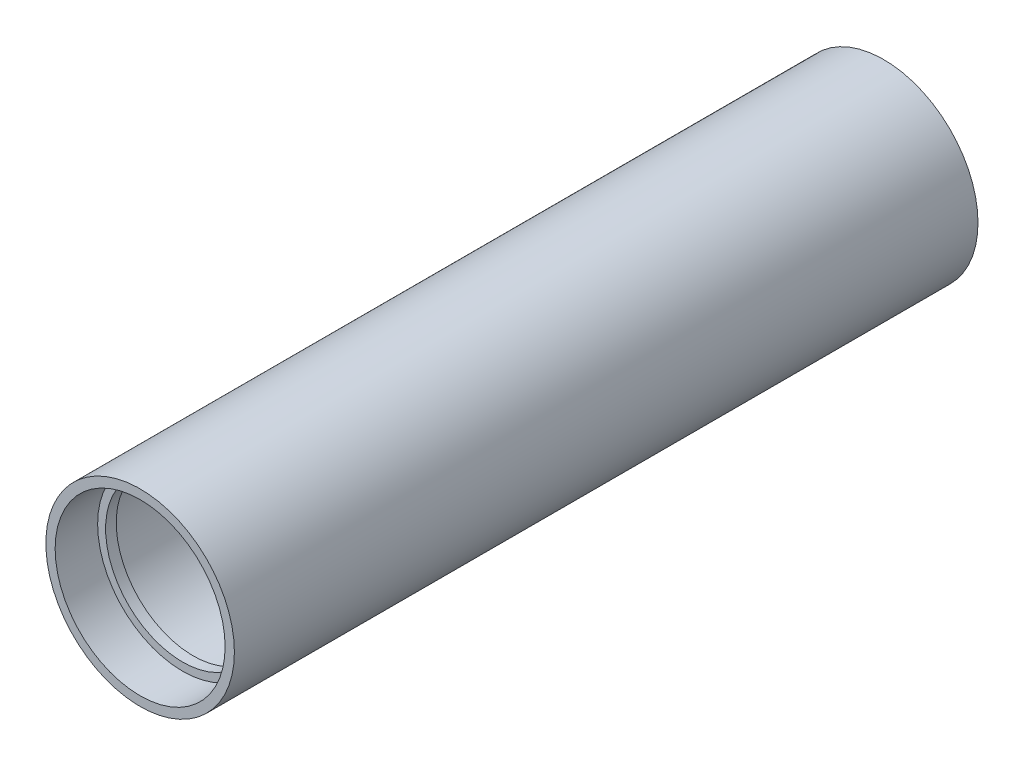
from build123d import *

# Parameters (mm, degrees)
SKETCH1_R           = 17.75
SKETCH1_R_2         = 16
BOSS_EXTRUDE1_DEPTH = 70
BOSS_EXTRUDE2_START = 60
SKETCH2_R           = 16
SKETCH2_R_2         = 14.5
BOSS_EXTRUDE2_DEPTH = 2


with BuildPart() as part:
    # Sketch1 → Boss-Extrude1 (new, symmetric)
    with BuildSketch(Plane.XY):
        Circle(SKETCH1_R)
        Circle(SKETCH1_R_2, mode=Mode.SUBTRACT)
    extrude(amount=BOSS_EXTRUDE1_DEPTH, both=True)

    # Sketch2 → Boss-Extrude2 (add)
    with BuildSketch(Plane.XY.offset(BOSS_EXTRUDE2_START)):
        Circle(SKETCH2_R)
        Circle(SKETCH2_R_2, mode=Mode.SUBTRACT)
    boss_extrude2 = extrude(amount=BOSS_EXTRUDE2_DEPTH)

    # Mirror1: Boss-Extrude2 across plane
    add(boss_extrude2.mirror(Plane.XY))


solid = part.part
